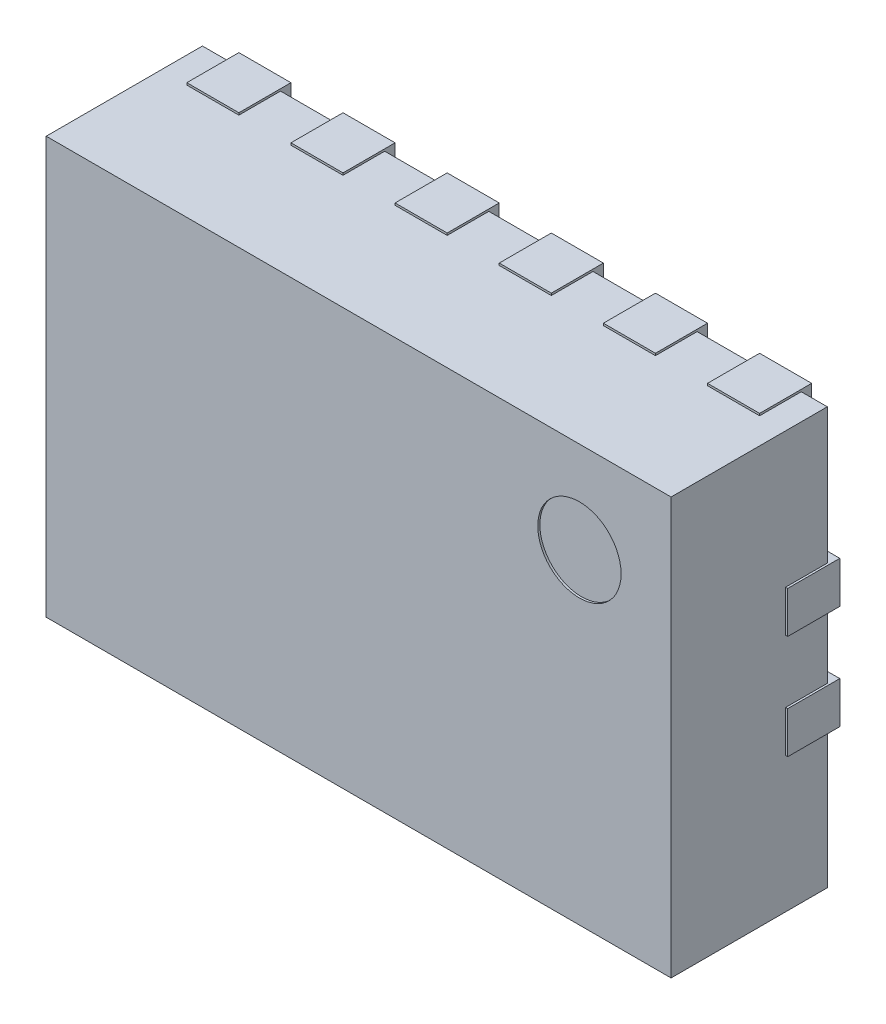
from build123d import *

# Parameters (mm, degrees)
SKETCH1_W                = 3
SKETCH1_H                = 2
BOSS_EXTRUDE1_DEPTH      = 0.75
SKETCH2_R                = 0.2
CUT_EXTRUDE1_DEPTH       = 0.01
BOSS_EXTRUDE2_DEPTH      = 0.05
BOSS_EXTRUDE2_DEPTH_BACK = 0.2
BOSS_EXTRUDE4_START      = -0.2
BOSS_EXTRUDE4_DEPTH      = 0.25
LPATTERN2_COUNT          = 6
LPATTERN2_PITCH          = 0.5
MIRROR2_START            = -0.2
MIRROR2_COPY_1_DEPTH     = 0.25
MIRROR2_COPY_2_DEPTH     = 0.25
MIRROR2_COPY_3_DEPTH     = 0.25
MIRROR2_COPY_4_DEPTH     = 0.25
MIRROR2_COPY_5_DEPTH     = 0.25


with BuildPart() as part:
    # Sketch1 → Boss-Extrude1 (new body)
    with BuildSketch(Plane.XY):
        Rectangle(SKETCH1_W, SKETCH1_H)
    extrude(amount=BOSS_EXTRUDE1_DEPTH)

    # Sketch2 → Cut-Extrude1 (cut)
    with BuildSketch(Plane.XY.offset(0.75)):
        with Locations((1.06, 0.56)):
            Circle(SKETCH2_R)
    extrude(amount=-CUT_EXTRUDE1_DEPTH, mode=Mode.SUBTRACT)

    # Sketch3 → Boss-Extrude2 (add, two sides: drawn at the far end of the back side and taken through both)
    with BuildSketch(Plane(origin=(0, 0, 0), x_dir=(-1, 0, 0), z_dir=(0, 0, -1)).offset(-BOSS_EXTRUDE2_DEPTH_BACK)):
        with BuildLine():
            Line((1, 0.35), (1.51, 0.35))
            Line((1.51, 0.35), (1.51, 0.15))
            Line((1.51, 0.15), (1, 0.15))
            Line((1, 0.15), (1, -0.15))
            Line((1, -0.15), (1.51, -0.15))
            Line((1.51, -0.15), (1.51, -0.35))
            Line((1.51, -0.35), (1, -0.35))
            Line((1, -0.35), (1, -0.4355))
            ThreePointArc((1, -0.4355), (0.995753048, -0.445753048), (0.9855, -0.45))
            Line((0.9855, -0.45), (-0.9855, -0.45))
            ThreePointArc((-0.9855, -0.45), (-0.995753048, -0.445753048), (-1, -0.4355))
            Line((-1, -0.4355), (-1, -0.35))
            Line((-1, -0.35), (-1.51, -0.35))
            Line((-1.51, -0.35), (-1.51, -0.15))
            Line((-1.51, -0.15), (-1, -0.15))
            Line((-1, -0.15), (-1, 0.15))
            Line((-1, 0.15), (-1.51, 0.15))
            Line((-1.51, 0.15), (-1.51, 0.35))
            Line((-1.51, 0.35), (-1, 0.35))
            Line((-1, 0.35), (-1, 0.4355))
            ThreePointArc((-1, 0.4355), (-0.995753048, 0.445753048), (-0.9855, 0.45))
            Line((-0.9855, 0.45), (0.9855, 0.45))
            ThreePointArc((0.9855, 0.45), (0.995753048, 0.445753048), (1, 0.4355))
            Line((1, 0.4355), (1, 0.35))
        make_face()
    extrude(amount=BOSS_EXTRUDE2_DEPTH + BOSS_EXTRUDE2_DEPTH_BACK)

    # Sketch6 → Boss-Extrude4 (add)
    with BuildSketch(Plane(origin=(0, 0, 0), x_dir=(-1, 0, 0), z_dir=(0, 0, -1)).offset(BOSS_EXTRUDE4_START)):
        with BuildLine():
            Line((-1.375, 1.01), (-1.125, 1.01))
            Line((-1.125, 1.01), (-1.125, 1))
            Line((-1.125, 1), (-1.125, 0.825))
            ThreePointArc((-1.125, 0.825), (-1.25, 0.7), (-1.375, 0.825))
            Line((-1.375, 0.825), (-1.375, 1))
            Line((-1.375, 1), (-1.375, 1.01))
        make_face()
    boss_extrude4 = extrude(amount=BOSS_EXTRUDE4_DEPTH)

    # LPattern2: Boss-Extrude4 ×6
    with Locations(*[(-i * LPATTERN2_PITCH, 0, 0) for i in range(1, LPATTERN2_COUNT)]):
        add(boss_extrude4)

    # Mirror2: Boss-Extrude4 across plane
    add(boss_extrude4.mirror(Plane.ZX))

    # Mirror2 copy 1 sketch → Mirror2 copy 1 (add)
    with BuildSketch(Plane(origin=(-0.5, 0, 0), x_dir=(-1, 0, 0), z_dir=(0, 0, -1)).offset(MIRROR2_START)):
        with BuildLine():
            Line((-1.375, -1.01), (-1.125, -1.01))
            Line((-1.125, -1.01), (-1.125, -1))
            Line((-1.125, -1), (-1.125, -0.825))
            ThreePointArc((-1.125, -0.825), (-1.25, -0.7), (-1.375, -0.825))
            Line((-1.375, -0.825), (-1.375, -1))
            Line((-1.375, -1), (-1.375, -1.01))
        make_face()
    extrude(amount=MIRROR2_COPY_1_DEPTH)

    # Mirror2 copy 2 sketch → Mirror2 copy 2 (add)
    with BuildSketch(Plane(origin=(-1, 0, 0), x_dir=(-1, 0, 0), z_dir=(0, 0, -1)).offset(MIRROR2_START)):
        with BuildLine():
            Line((-1.375, -1.01), (-1.125, -1.01))
            Line((-1.125, -1.01), (-1.125, -1))
            Line((-1.125, -1), (-1.125, -0.825))
            ThreePointArc((-1.125, -0.825), (-1.25, -0.7), (-1.375, -0.825))
            Line((-1.375, -0.825), (-1.375, -1))
            Line((-1.375, -1), (-1.375, -1.01))
        make_face()
    extrude(amount=MIRROR2_COPY_2_DEPTH)

    # Mirror2 copy 3 sketch → Mirror2 copy 3 (add)
    with BuildSketch(Plane(origin=(-1.5, 0, 0), x_dir=(-1, 0, 0), z_dir=(0, 0, -1)).offset(MIRROR2_START)):
        with BuildLine():
            Line((-1.375, -1.01), (-1.125, -1.01))
            Line((-1.125, -1.01), (-1.125, -1))
            Line((-1.125, -1), (-1.125, -0.825))
            ThreePointArc((-1.125, -0.825), (-1.25, -0.7), (-1.375, -0.825))
            Line((-1.375, -0.825), (-1.375, -1))
            Line((-1.375, -1), (-1.375, -1.01))
        make_face()
    extrude(amount=MIRROR2_COPY_3_DEPTH)

    # Mirror2 copy 4 sketch → Mirror2 copy 4 (add)
    with BuildSketch(Plane(origin=(-2, 0, 0), x_dir=(-1, 0, 0), z_dir=(0, 0, -1)).offset(MIRROR2_START)):
        with BuildLine():
            Line((-1.375, -1.01), (-1.125, -1.01))
            Line((-1.125, -1.01), (-1.125, -1))
            Line((-1.125, -1), (-1.125, -0.825))
            ThreePointArc((-1.125, -0.825), (-1.25, -0.7), (-1.375, -0.825))
            Line((-1.375, -0.825), (-1.375, -1))
            Line((-1.375, -1), (-1.375, -1.01))
        make_face()
    extrude(amount=MIRROR2_COPY_4_DEPTH)

    # Mirror2 copy 5 sketch → Mirror2 copy 5 (add)
    with BuildSketch(Plane(origin=(-2.5, 0, 0), x_dir=(-1, 0, 0), z_dir=(0, 0, -1)).offset(MIRROR2_START)):
        with BuildLine():
            Line((-1.375, -1.01), (-1.125, -1.01))
            Line((-1.125, -1.01), (-1.125, -1))
            Line((-1.125, -1), (-1.125, -0.825))
            ThreePointArc((-1.125, -0.825), (-1.25, -0.7), (-1.375, -0.825))
            Line((-1.375, -0.825), (-1.375, -1))
            Line((-1.375, -1), (-1.375, -1.01))
        make_face()
    extrude(amount=MIRROR2_COPY_5_DEPTH)


solid = part.part
